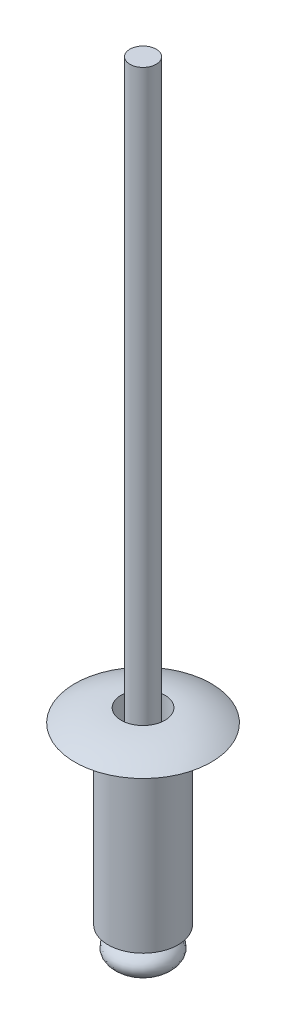
from build123d import *


with BuildPart() as part:
    # Szkic1 → Obrót1 (revolve)
    with BuildSketch(Plane.XY, mode=Mode.PRIVATE) as obr_t1_sk:
        with BuildLine():
            Line((-1.25, 10.75), (-1.25, 0))
            Line((-1.25, 0), (-2, 0))
            Line((-2, 0), (-2, 10))
            Line((-2, 10), (-3.9, 10))
            ThreePointArc((-3.9, 10), (-2.627043935, 10.558888572), (-1.25, 10.75))
        make_face()
        with BuildLine():
            Line((-1.24, 1), (-1.24, -0.5))
            add(Edge.make_bspline(
                [(-1.24, -0.5), (-4.212515907, -2), (0, -2)],
                knots=[5.499860619, 5.499860619, 5.499860619, 7.853981634, 7.853981634, 7.853981634], degree=2, weights=[1, 0.383641047, 1]))
            Line((0, -2), (0, 43))
            Line((0, 43), (-0.75, 43))
            Line((-0.75, 43), (-0.75, 1))
            Line((-0.75, 1), (-1.24, 1))
        make_face()
    revolve(obr_t1_sk.sketch.rotate(Axis((0, 0, 0), (0, 1, 0)), 270), axis=Axis((0, 0, 0), (0, 1, 0)))


solid = part.part
